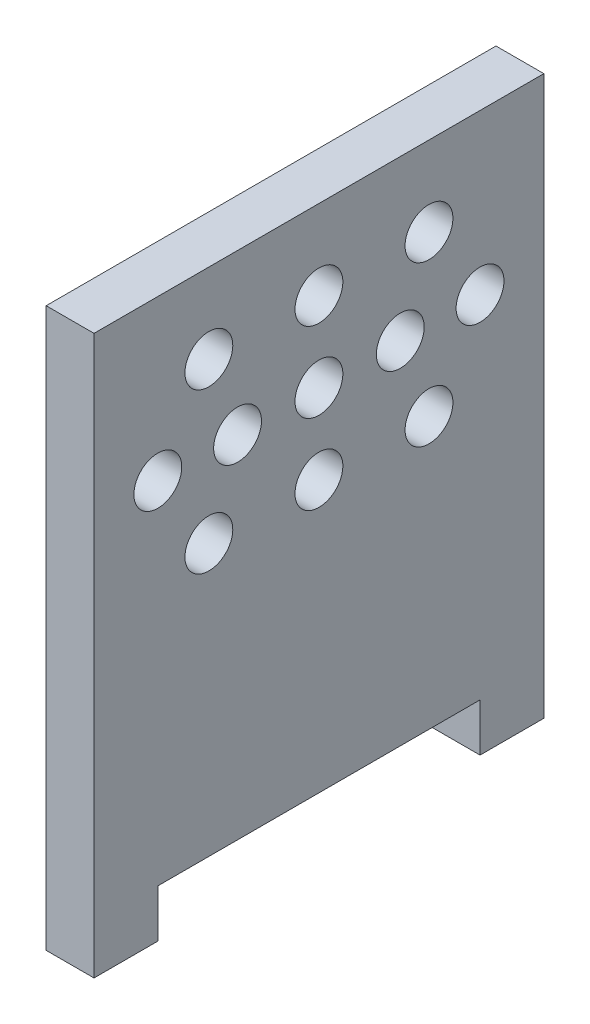
from build123d import *

# Parameters (mm, degrees)
ESQUISSE1_R        = 1.5
BOSS_EXTRU_1_DEPTH = 3


with BuildPart() as part:
    # Esquisse1 → Boss.-Extru.1 (new body)
    with BuildSketch(Plane(origin=(-3, 0, 0), x_dir=(0, -1, 0), z_dir=(-1, 0, 0))):
        Polygon((35, 27.2), (0, 27.2), (0, -1), (35, -1), (35, 3), (32, 3), (32, 23.2), (35, 23.2), align=None)
        with Locations(Location((5, 6.2, 0), (0, 0, 180))):
            Circle(ESQUISSE1_R, mode=Mode.SUBTRACT)
        with Locations(Location((10, 8, 0), (0, 0, 180))):
            Circle(ESQUISSE1_R, mode=Mode.SUBTRACT)
        with Locations(Location((15, 20, 0), (0, 0, 180))):
            Circle(ESQUISSE1_R, mode=Mode.SUBTRACT)
        with Locations(Location((5, 20, 0), (0, 0, 180))):
            Circle(ESQUISSE1_R, mode=Mode.SUBTRACT)
        with Locations(Location((15, 6.2, 0), (0, 0, 180))):
            Circle(ESQUISSE1_R, mode=Mode.SUBTRACT)
        with Locations(Location((10, 13.1, 0), (0, 0, 180))):
            Circle(ESQUISSE1_R, mode=Mode.SUBTRACT)
        with Locations(Location((10, 3, 0), (0, 0, 180))):
            Circle(ESQUISSE1_R, mode=Mode.SUBTRACT)
        with Locations(Location((5, 13.1, 0), (0, 0, 180))):
            Circle(ESQUISSE1_R, mode=Mode.SUBTRACT)
        with Locations(Location((15, 13.1, 0), (0, 0, 180))):
            Circle(ESQUISSE1_R, mode=Mode.SUBTRACT)
        with Locations(Location((9.99998284, 23.2, 0), (0, 0, 180))):
            Circle(ESQUISSE1_R, mode=Mode.SUBTRACT)
        with Locations(Location((9.99998284, 18.2, 0), (0, 0, 180))):
            Circle(ESQUISSE1_R, mode=Mode.SUBTRACT)
    extrude(amount=-BOSS_EXTRU_1_DEPTH)


solid = part.part
